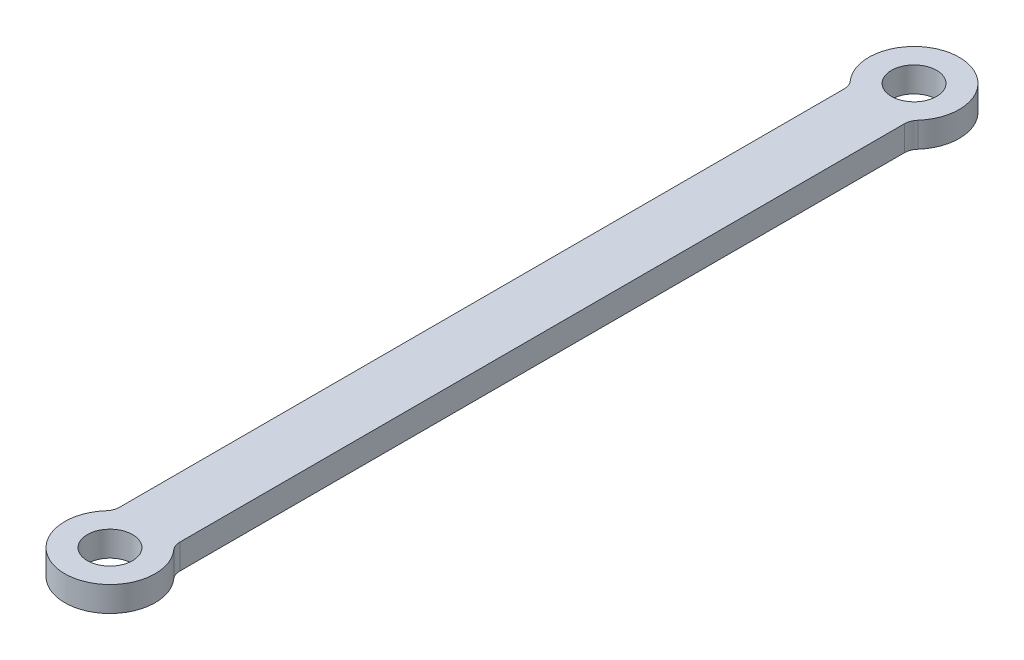
from build123d import *

# Parameters (mm, degrees)
SKETCH_1_R      = 4.5
EXTRUDE_1_DEPTH = 5


with BuildPart() as part:
    # 草图1 → 凸台-拉伸1 (new body)
    with BuildSketch(Plane(origin=(0, 0, 0), x_dir=(1, 0, 0), z_dir=(0, 1, 0))):
        with BuildLine():
            Line((-81.88976378, 37.732037405), (-81.88976378, -106.393454728))
            ThreePointArc((-81.88976378, -106.393454728), (-82.083520739, -107.4541149), (-82.63976378, -108.377768212))
            ThreePointArc((-82.63976378, -108.377768212), (-75.88976378, -123.330708661), (-69.13976378, -108.377768212))
            ThreePointArc((-69.13976378, -108.377768212), (-69.69600682, -107.4541149), (-69.88976378, -106.393454728))
            Line((-69.88976378, -106.393454728), (-69.88976378, 37.732037405))
            ThreePointArc((-69.88976378, 37.732037405), (-69.69600682, 38.792697577), (-69.13976378, 39.716350889))
            ThreePointArc((-69.13976378, 39.716350889), (-75.88976378, 54.669291339), (-82.63976378, 39.716350889))
            ThreePointArc((-82.63976378, 39.716350889), (-82.083520739, 38.792697577), (-81.88976378, 37.732037405))
        make_face()
        with Locations(Location((-75.88976378, 45.669291339, 0), (0, 0, 270))):
            Circle(SKETCH_1_R, mode=Mode.SUBTRACT)
        with Locations(Location((-75.88976378, -114.330708661, 0), (0, 0, 270))):
            Circle(SKETCH_1_R, mode=Mode.SUBTRACT)
    extrude(amount=EXTRUDE_1_DEPTH)


solid = part.part
